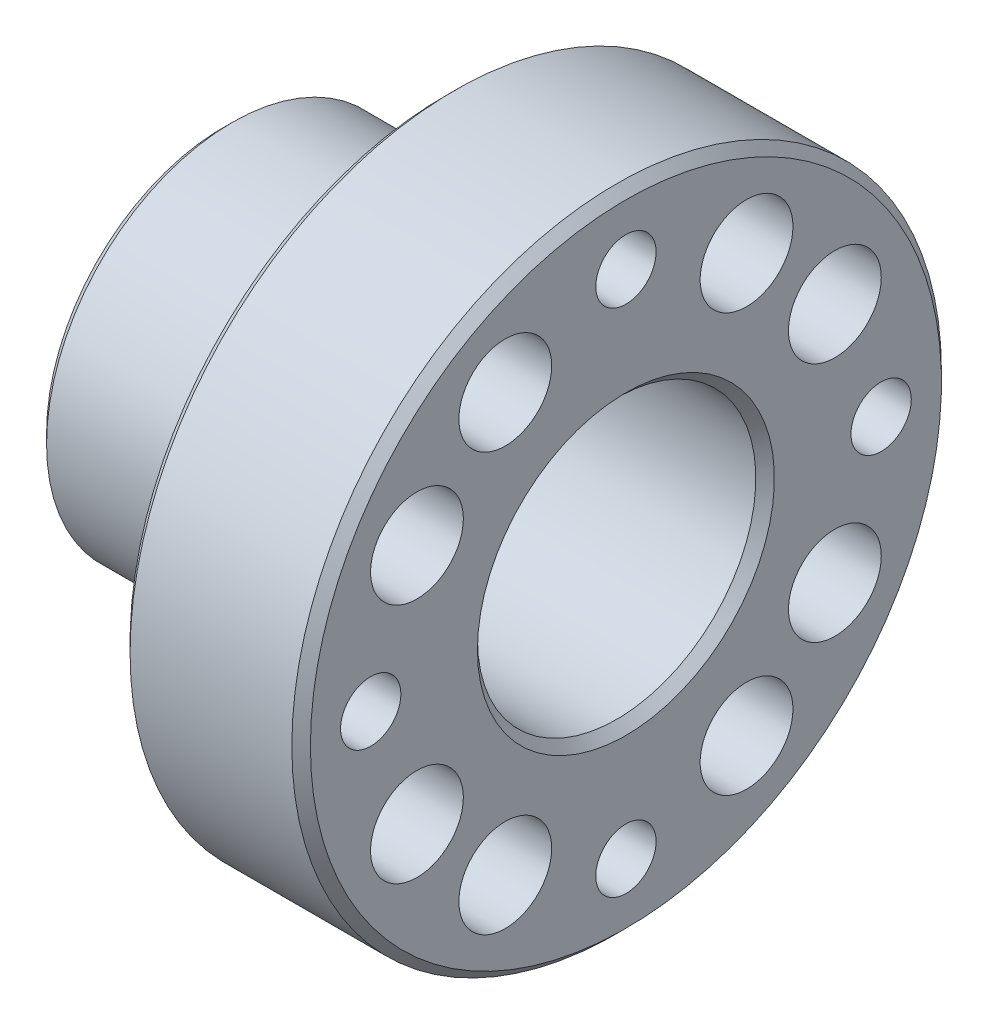
from build123d import *

# Parameters (mm, degrees)
SKETCH2_R              = 3.25
CUT_EXTRUDE1_DEPTH     = 66.849562641
CHAMFER1_SIZE          = 1
SKETCH3_R              = 5
LIGHTENING_HOLES_DEPTH = 66.849562641


with BuildPart() as part:
    # Sketch1 → Revolve1 (revolve)
    with BuildSketch(Plane(origin=(0, 0, 0), x_dir=(1, 0, 0), z_dir=(0, 1, 0)), mode=Mode.PRIVATE) as revolve1_sk:
        Polygon((0, 20), (24, 20), (24, 35), (43.43, 35), (43.43, 15), (0, 15), align=None)
    revolve(revolve1_sk.sketch.rotate(Axis((0, 0, 0), (1, 0, 0)), 180), axis=Axis((0, 0, 0), (1, 0, 0)))

    # Sketch2 → Cut-Extrude1 (cut, through all)
    with BuildSketch(Plane(origin=(43.43, 0, 0), x_dir=(0, 0, -1), z_dir=(1, 0, 0))):
        with Locations((0, 27.5)):
            Circle(SKETCH2_R)
        with Locations((27.5, 0)):
            Circle(SKETCH2_R)
        with Locations((-27.5, 0)):
            Circle(SKETCH2_R)
        with Locations((0, -27.5)):
            Circle(SKETCH2_R)
    extrude(amount=-CUT_EXTRUDE1_DEPTH, mode=Mode.SUBTRACT)

    # Chamfer1
    chamfer1_edges = [part.edges().sort_by_distance(p)[0] for p in [
        (0, 0, -15),
        (43.43, 0, -15),
        (43.43, 0, -35),
        (24, 0, -35),
        (24, 0, -20),
        (0, 0, -20),
    ]]
    chamfer(chamfer1_edges, length=CHAMFER1_SIZE)

    # Sketch3 → lightening holes (cut, through all)
    with BuildSketch(Plane(origin=(43.43, 0, 0), x_dir=(0, 0, -1), z_dir=(1, 0, 0))):
        with Locations((13, 22.516660498)):
            Circle(SKETCH3_R)
        with Locations((22.516660498, 13)):
            Circle(SKETCH3_R)
        with Locations((22.516660498, -13)):
            Circle(SKETCH3_R)
        with Locations((13, -22.516660498)):
            Circle(SKETCH3_R)
        with Locations((-13, -22.516660498)):
            Circle(SKETCH3_R)
        with Locations((-22.516660498, -13)):
            Circle(SKETCH3_R)
        with Locations((-22.516660498, 13)):
            Circle(SKETCH3_R)
        with Locations((-13, 22.516660498)):
            Circle(SKETCH3_R)
    extrude(amount=-LIGHTENING_HOLES_DEPTH, mode=Mode.SUBTRACT)


solid = part.part
